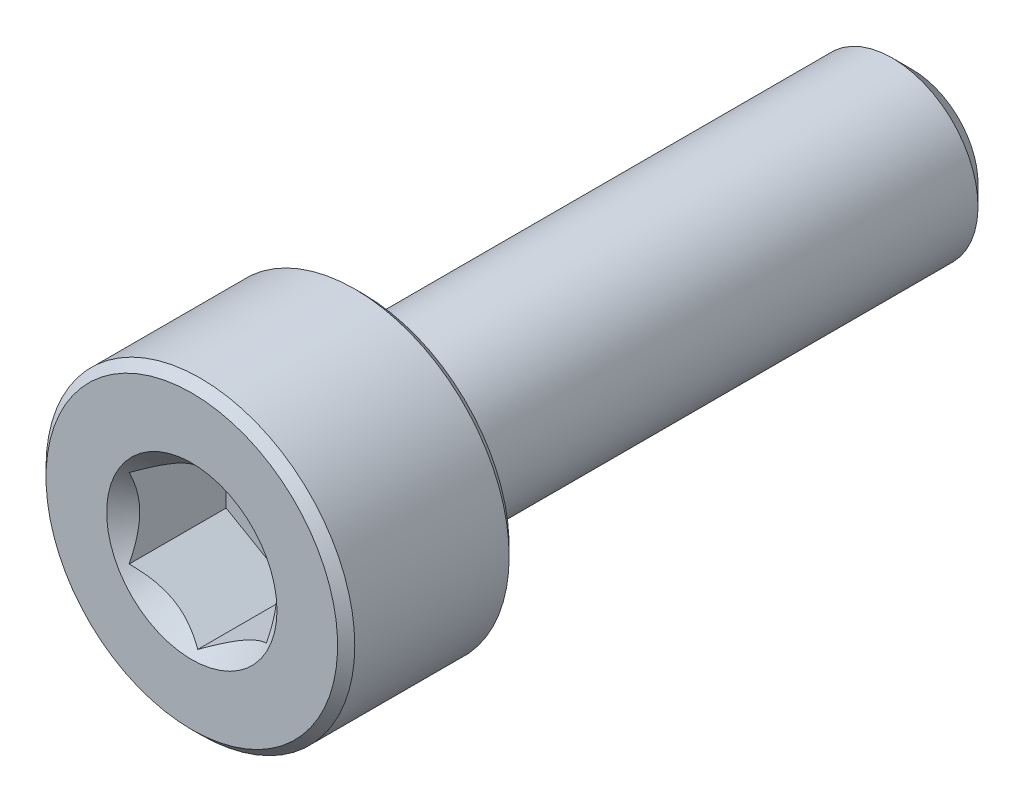
from build123d import *

# Parameters (mm, degrees)
CUT_EXTRUDE1_DEPTH     = 1.5
SPLIT1_SURFACE_1_BACK  = 13.278
SPLIT1_SURFACE_1_DEPTH = 26.556
SPLIT1_SURFACE_2_BACK  = 13.278
SPLIT1_SURFACE_2_DEPTH = 26.556


with BuildPart() as part:
    # Sketch2 → Revolve1 (revolve)
    with BuildSketch(Plane(origin=(0, 0, 0), x_dir=(0, 0, -1), z_dir=(1, 0, 0))):
        with BuildLine():
            Line((-5.25, 0), (-5.25, 2.125))
            Line((-5.25, 2.125), (-5.125, 2.25))
            Line((-5.125, 2.25), (-2.875, 2.25))
            Line((-2.875, 2.25), (-2.75, 2.125))
            Line((-2.75, 2.125), (-2.75, 1.375))
            ThreePointArc((-2.75, 1.375), (-2.713388348, 1.286611652), (-2.625, 1.25))
            Line((-2.625, 1.25), (4.957716426, 1.25))
            Line((4.957716426, 1.25), (5.25, 0.957716426))
            Line((5.25, 0.957716426), (5.25, 0))
            Line((5.25, 0), (-5.25, 0))
        make_face()
    revolve(axis=Axis((0, 0, -5.25), (0, 0, 1)))

    # Sketch3 → Cut-Extrude1 (cut)
    with BuildSketch(Plane.XY.offset(5.25)):
        Polygon((1, -0.577350269), (1, 0.577350269), (0, 1.154700538), (-1, 0.577350269), (-1, -0.577350269), (0, -1.154700538), align=None)
    extrude(amount=-CUT_EXTRUDE1_DEPTH, mode=Mode.SUBTRACT)

    # Cut-Extrude2 cone 1 section (through the dimple's axis) → Cut-Extrude2 (revolve, cut)
    with BuildSketch(Plane(origin=(0, 0, 5.25), x_dir=(0, -1, 0), z_dir=(1, 0, 0))):
        Polygon((0, 0), (1.241303079, 0), (0, 1.241303079), align=None)
    revolve(axis=Axis((0, 0, 5.25), (0, 0, -1)), mode=Mode.SUBTRACT)


with BuildPart() as body_2:
    # Split1: the piece behind the surface
    add(part.part)
    # Split1 surface: a surface, the sketch's curves swept straight by 26.556 mm
    with BuildLine(Plane(origin=(0, 0, 0), x_dir=(0, 0, -1), z_dir=(1, 0, 0)).offset(-SPLIT1_SURFACE_1_BACK), mode=Mode.PRIVATE) as split1_surface_1_path:
        Line((-2.625, -2.25), (-2.625, 2.25))
    split1_surface_1 = Shell.extrude(split1_surface_1_path.wire(), (1 * SPLIT1_SURFACE_1_DEPTH, 0 * SPLIT1_SURFACE_1_DEPTH, 0 * SPLIT1_SURFACE_1_DEPTH))
    split(bisect_by=split1_surface_1, keep=Keep.BOTTOM)


with BuildPart() as part_1:
    add(part.part)

    # Split1: split by a surface, the side it looks to stays
    # Split1 surface: a surface, the sketch's curves swept straight by 26.556 mm
    with BuildLine(Plane(origin=(0, 0, 0), x_dir=(0, 0, -1), z_dir=(1, 0, 0)).offset(-SPLIT1_SURFACE_2_BACK), mode=Mode.PRIVATE) as split1_surface_2_path:
        Line((-2.625, -2.25), (-2.625, 2.25))
    split1_surface_2 = Shell.extrude(split1_surface_2_path.wire(), (1 * SPLIT1_SURFACE_2_DEPTH, 0 * SPLIT1_SURFACE_2_DEPTH, 0 * SPLIT1_SURFACE_2_DEPTH))
    split(bisect_by=split1_surface_2, keep=Keep.TOP)

    # Sketch8 → Revolve2 (revolve)
    with BuildSketch(Plane(origin=(0, 0, 0), x_dir=(0, 0, -1), z_dir=(1, 0, 0)), mode=Mode.PRIVATE) as revolve2_sk:
        Polygon((-2.75, 0), (-2.75, 1.25), (-2.625, 1.25), (-1.903312164, 0), align=None)
    revolve(revolve2_sk.sketch.rotate(Axis((0, 0, 1.903312164), (0, 0, 1)), 270), axis=Axis((0, 0, 1.903312164), (0, 0, 1)))


solid = Compound([body_2.part, part_1.part])
